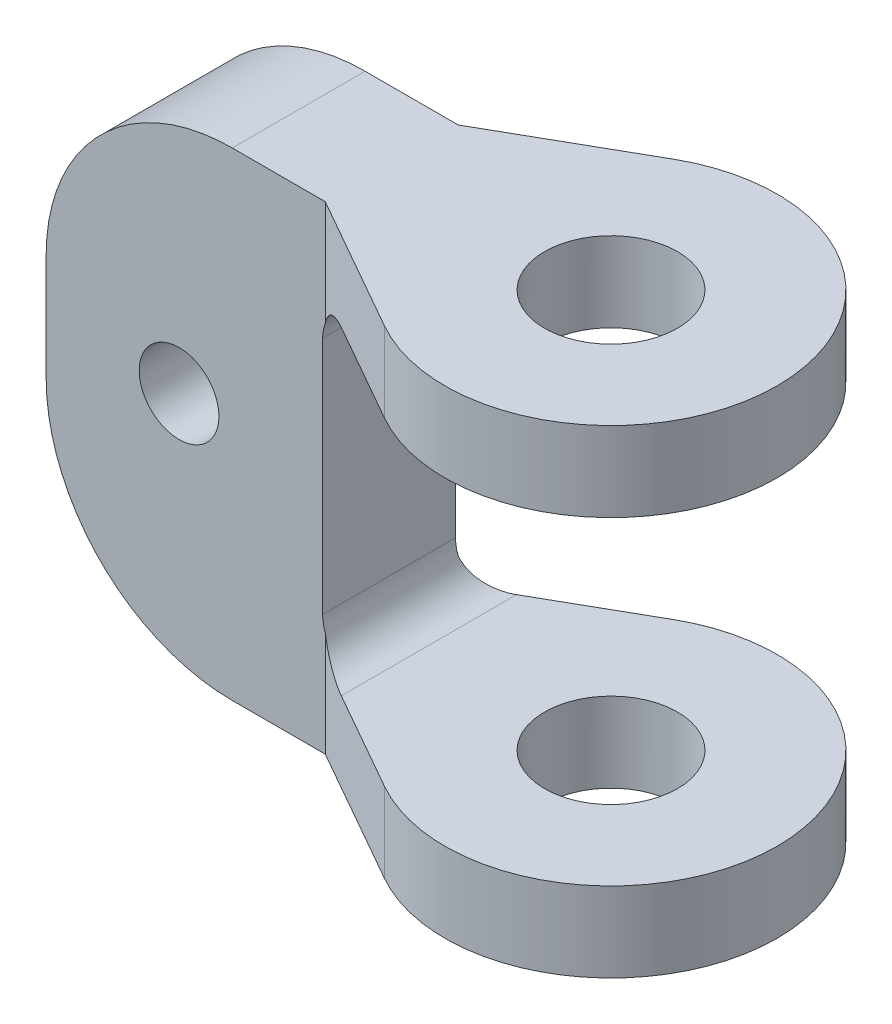
from build123d import *
from build123d.topology import SkipClean

# Parameters (mm, degrees)
CROQUIS1_R              = 1.5
SALIENTE_EXTRUIR1_DEPTH = 15
CROQUIS2_R              = 2.5
CORTAR_EXTRUIR1_DEPTH   = 20
CORTAR_EXTRUIR2_DEPTH   = 22
CROQUIS4_W              = 3.68086323
CROQUIS4_H              = 12
CORTAR_EXTRUIR3_DEPTH   = 10
REDONDEO1_R             = 1.5


with BuildPart() as part:
    # Croquis1 → Saliente-Extruir1 (new body)
    with BuildSketch(Plane.XY):
        with BuildLine():
            Line((11.25, 14.1), (11.25, 11.1))
            Line((11.25, 11.1), (11.25, 5.1))
            Line((11.25, 5.1), (11.25, 2.1))
            Line((11.25, 2.1), (23.75, 2.1))
            Line((23.75, 2.1), (23.75, -0.9))
            Line((23.75, -0.9), (11.25, -0.9))
            Line((11.25, -0.9), (5.75, -0.9))
            ThreePointArc((5.75, -0.9), (0.800252532, 1.150252532), (-1.25, 6.1))
            Line((-1.25, 6.1), (-1.25, 10.1))
            ThreePointArc((-1.25, 10.1), (0.800252532, 15.049747468), (5.75, 17.1))
            Line((5.75, 17.1), (11.25, 17.1))
            Line((11.25, 17.1), (23.75, 17.1))
            Line((23.75, 17.1), (23.75, 14.1))
            Line((23.75, 14.1), (11.25, 14.1))
        make_face()
        with Locations((3.75, 8.1)):
            Circle(CROQUIS1_R, mode=Mode.SUBTRACT)
    extrude(amount=SALIENTE_EXTRUIR1_DEPTH)

    # Croquis2 → Cortar-Extruir1 (cut, symmetric)
    with BuildSketch(Plane(origin=(0, 0, 0), x_dir=(1, 0, 0), z_dir=(0, 1, 0))):
        with Locations(Location((17.5, -7.5, 0), (0, 0, 90))):
            Circle(CROQUIS2_R)
        with BuildLine():
            Line((17.5, -1.25), (11.25, 0))
            Line((11.25, 0), (11.126279301, 1.868603497))
            Line((11.126279301, 1.868603497), (29.663453957, 1.868603497))
            Line((29.663453957, 1.868603497), (29.663453957, -17.961269996))
            Line((29.663453957, -17.961269996), (11.25, -17.961269996))
            Line((11.25, -17.961269996), (11.25, -15))
            Line((11.25, -15), (17.5, -13.75))
            ThreePointArc((17.5, -13.75), (23.75, -7.5), (17.5, -1.25))
        make_face()
    extrude(amount=CORTAR_EXTRUIR1_DEPTH, both=True, mode=Mode.SUBTRACT)

    # Croquis3 → Cortar-Extruir2 (cut)
    with SkipClean():  # the faces are left unmerged after this step: merging them gives an invalid solid
        with BuildSketch(Plane(origin=(0, 17.1, 0), x_dir=(1, 0, 0), z_dir=(0, 1, 0))):
            Polygon((5.75, -10), (-2.050741432, -10), (-2.325121179, -18.2596058), (20.840368904, -18.2596058), (17.5, -13.75), (11.25, -15), (5.75, -15), align=None)
            with BuildLine():
                Line((9.25, -10), (5.75, -10))
                Line((5.75, -10), (5.75, -15))
                Line((5.75, -15), (11.25, -15))
                Line((11.25, -15), (17.5, -13.75))
                ThreePointArc((17.5, -13.75), (15.902831918, -13.542479137), (14.41172646, -12.933697318))
                Line((14.41172646, -12.933697318), (9.25, -10))
            make_face()
            with BuildLine():
                Line((5.75, 0), (5.75, -5))
                Line((5.75, -5), (9.25, -5))
                Line((9.25, -5), (14.41172646, -2.066302682))
                ThreePointArc((14.41172646, -2.066302682), (15.902831918, -1.457520863), (17.5, -1.25))
                Line((17.5, -1.25), (11.25, 0))
                Line((11.25, 0), (5.75, 0))
            make_face()
            Polygon((-2.050741432, -5), (5.75, -5), (5.75, 0), (11.25, 0), (17.5, -1.25), (17.5, 1.613327317), (-2.050741432, 1.613327317), align=None)
        extrude(amount=-CORTAR_EXTRUIR2_DEPTH, mode=Mode.SUBTRACT)

    # Croquis4 → Cortar-Extruir3 (cut, symmetric)
    with SkipClean():  # the faces are left unmerged after this step: merging them gives an invalid solid
        with BuildSketch(Plane.XY.offset(10)):
            with Locations((10.990431615, 8.1)):
                Rectangle(CROQUIS4_W, CROQUIS4_H)
        extrude(amount=CORTAR_EXTRUIR3_DEPTH, both=True, mode=Mode.SUBTRACT)

    # Redondeo1
    redondeo1_edges = [part.edges().sort_by_distance(p)[0] for p in [
        (9.15, 2.1, 7.5),
        (9.15, 14.1, 7.5),
    ]]
    fillet(redondeo1_edges, radius=REDONDEO1_R)


solid = part.part
